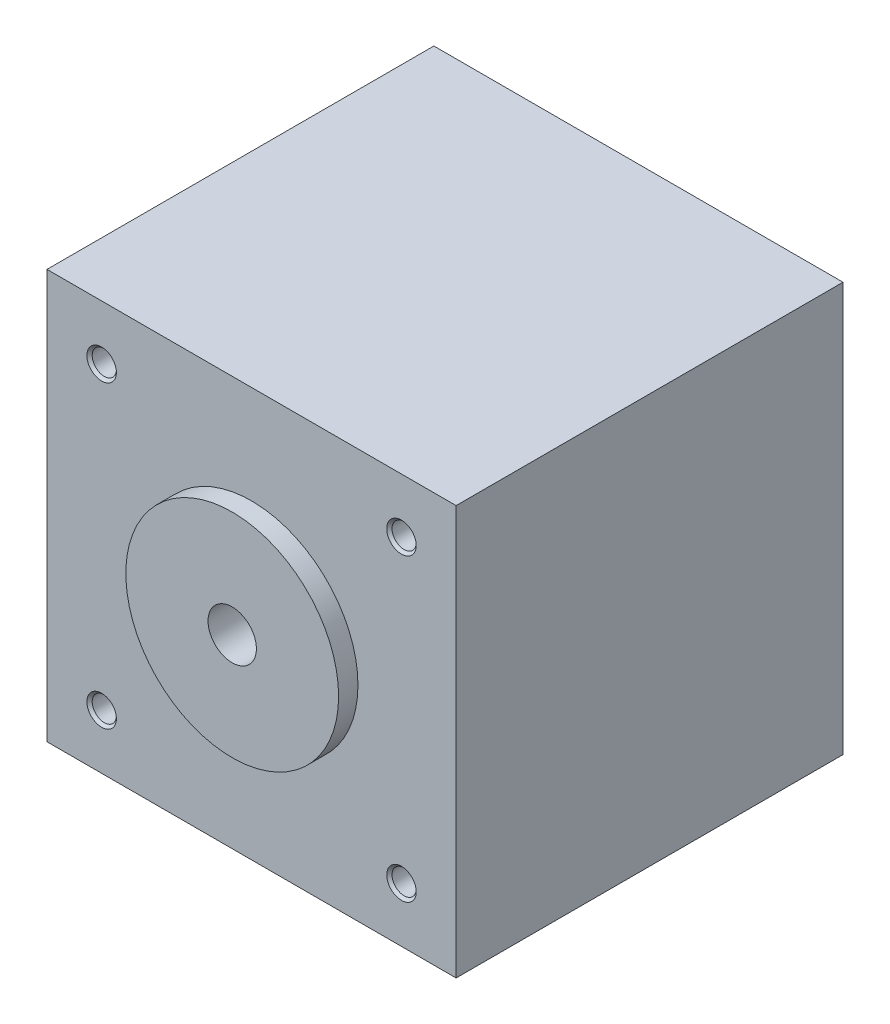
from build123d import *

# Parameters (mm, degrees)
SKETCH_1_W                   = 42.3
SKETCH_1_H                   = 42.3
EXTRUDE_1_DEPTH              = 40
HOLE_WIZARD_M3_1_D           = 2.5
HOLE_WIZARD_M3_1_DEPTH       = 8.5
HOLE_WIZARD_M3_1_CSINK_D     = 3.05
HOLE_WIZARD_M3_1_CSINK_ANGLE = 90
HOLE_WIZARD_M3_1_TIP         = 0.751075774
SKETCH_6_R                   = 11
EXTRUDE_2_DEPTH              = 2
SKETCH_7_R                   = 2.5
CUT_EXTRUDE_1_DEPTH          = 54.203806255


with BuildPart() as part:
    # 스케치1 → 보스-돌출1 (new body)
    with BuildSketch(Plane.XY):
        Rectangle(SKETCH_1_W, SKETCH_1_H)
    extrude(amount=EXTRUDE_1_DEPTH)

    # M3 나사 구멍1
    with Locations(Plane.XY.offset(40)):
        with Locations((-15.5, 15.5), (15.5, 15.5), (15.5, -15.5), (-15.5, -15.5)):
            CounterSinkHole(HOLE_WIZARD_M3_1_D / 2, HOLE_WIZARD_M3_1_CSINK_D / 2, depth=HOLE_WIZARD_M3_1_DEPTH, counter_sink_angle=HOLE_WIZARD_M3_1_CSINK_ANGLE)
            with Locations((0, 0, -(HOLE_WIZARD_M3_1_DEPTH + HOLE_WIZARD_M3_1_TIP / 2))):  # 118° drill point
                Cone(0, HOLE_WIZARD_M3_1_D / 2, HOLE_WIZARD_M3_1_TIP, mode=Mode.SUBTRACT)

    # 스케치6 → 보스-돌출2 (add)
    with BuildSketch(Plane.XY.offset(40)):
        Circle(SKETCH_6_R)
    extrude_2 = extrude(amount=EXTRUDE_2_DEPTH)

    # 대칭 복사1: 보스-돌출2 across plane
    add(extrude_2.mirror(Plane(origin=(0, 0, 20), x_dir=(1, 0, 0), z_dir=(0, 0, -1))))

    # 스케치7 → 컷-돌출1 (cut, through all)
    with BuildSketch(Plane.XY.offset(42)):
        Circle(SKETCH_7_R)
    extrude(amount=-CUT_EXTRUDE_1_DEPTH, mode=Mode.SUBTRACT)


solid = part.part
